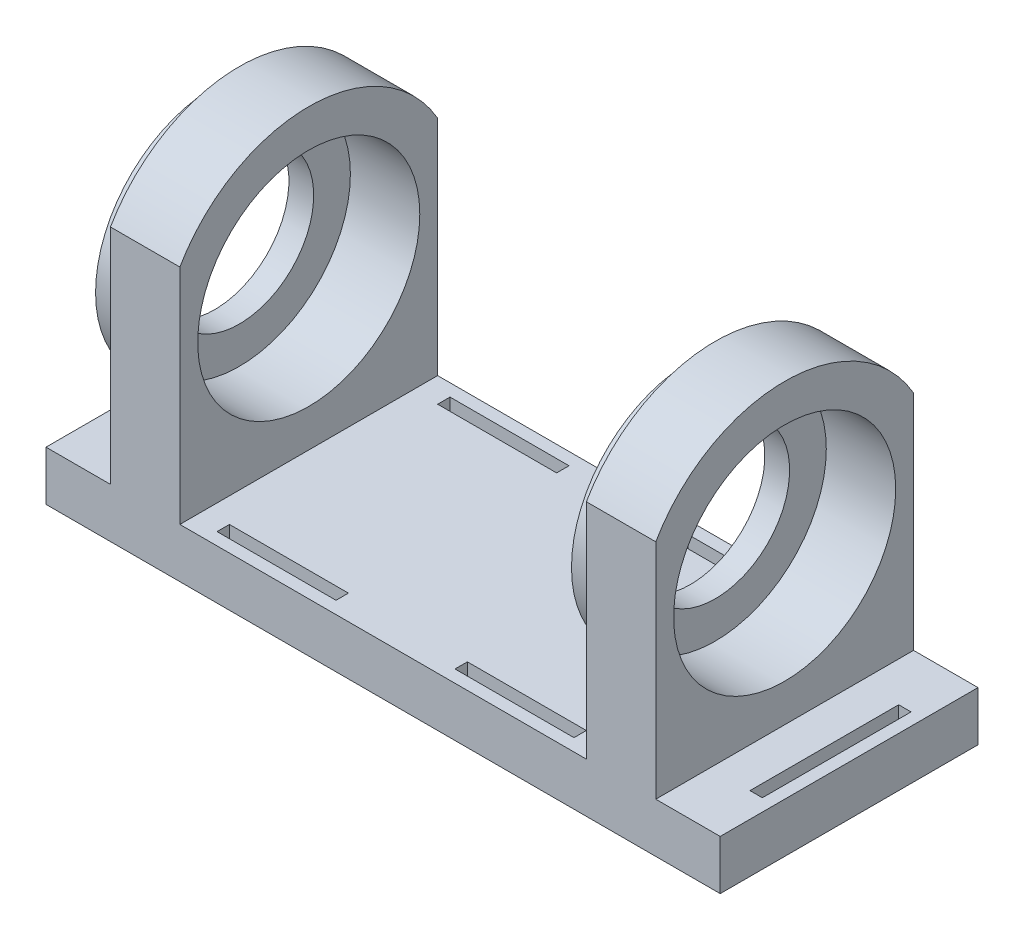
from build123d import *

# Parameters (mm, degrees)
SKETCH1_W            = 20
SKETCH1_H            = 26
SKETCH1_W_2          = 1.25
SKETCH1_H_2          = 15
BOSS_EXTRUDE5_DEPTH  = 5
SKETCH3_W            = 7
SKETCH3_H            = 26
BOSS_EXTRUDE6_DEPTH  = 40
CUT_EXTRUDE1_REACH   = 55.696
SKETCH5_R            = 11.2
SKETCH6_W            = 26
SKETCH6_H            = 5
BOSS_EXTRUDE8_DEPTH  = 14
SKETCH8_R            = 12
SKETCH8_R_2          = 7.5
BOSS_EXTRUDE9_DEPTH  = 2.5
SKETCH9_R            = 12
SKETCH9_R_2          = 7.5
BOSS_EXTRUDE10_DEPTH = 2.5
SKETCH7_W            = 12
SKETCH7_H            = 1.25
CUT_EXTRUDE2_DEPTH   = 10


with BuildPart() as part:
    # Sketch1 → Boss-Extrude5 (new body)
    with BuildSketch(Plane(origin=(0, 0, 0), x_dir=(1, 0, 0), z_dir=(0, 1, 0))):
        with Locations((10, 13)):
            Rectangle(SKETCH1_W, SKETCH1_H)
        with Locations((1.875, 13)):
            Rectangle(SKETCH1_W_2, SKETCH1_H_2, mode=Mode.SUBTRACT)
    boss_extrude5 = extrude(amount=BOSS_EXTRUDE5_DEPTH)

    # Sketch3 → Boss-Extrude6 (add)
    with BuildSketch(Plane(origin=(0, 5, 0), x_dir=(1, 0, 0), z_dir=(0, 1, 0))):
        with Locations((10, 13)):
            Rectangle(SKETCH3_W, SKETCH3_H)
    boss_extrude6 = extrude(amount=BOSS_EXTRUDE6_DEPTH)

    # Sketch5 → Cut-Extrude1 (cut, up to next)
    with BuildSketch(Plane(origin=(13.5, 0, 0), x_dir=(0, 0, -1), z_dir=(1, 0, 0)), mode=Mode.PRIVATE) as cut_extrude1_sk1:
        with Locations((13, 20)):
            Circle(SKETCH5_R)
    cut_extrude1_tool1 = extrude(cut_extrude1_sk1.sketch, amount=-CUT_EXTRUDE1_REACH, mode=Mode.PRIVATE) & part.part
    # Sketch5 → Cut-Extrude1 (cut, up to next)
    with BuildSketch(Plane(origin=(13.5, 0, 0), x_dir=(0, 0, -1), z_dir=(1, 0, 0)), mode=Mode.PRIVATE) as cut_extrude1_sk2:
        with BuildLine():
            Line((0, 27.483314774), (0, 45))
            Line((0, 45), (26, 45))
            Line((26, 45), (26, 27.483314774))
            ThreePointArc((26, 27.483314774), (13, 35), (0, 27.483314774))
        make_face()
    cut_extrude1_tool2 = extrude(cut_extrude1_sk2.sketch, amount=-CUT_EXTRUDE1_REACH, mode=Mode.PRIVATE) & part.part
    cut_extrude1_1 = cut_extrude1_tool1.solids().sort_by_distance((13.5, 20, -13))[0]
    add(cut_extrude1_1, mode=Mode.SUBTRACT)
    cut_extrude1_2 = cut_extrude1_tool2.solids().sort_by_distance((13.5, 38.725293, -13))[0]
    add(cut_extrude1_2, mode=Mode.SUBTRACT)
    cut_extrude1 = cut_extrude1_1 + cut_extrude1_2  # Cut-Extrude1 as one shape, for the pattern or mirror that repeats it

    # Sketch6 → Boss-Extrude8 (add)
    with BuildSketch(Plane(origin=(20, 0, 0), x_dir=(0, 0, -1), z_dir=(1, 0, 0))):
        with Locations((13, 2.5)):
            Rectangle(SKETCH6_W, SKETCH6_H)
    boss_extrude8 = extrude(amount=BOSS_EXTRUDE8_DEPTH)

    # Mirror5: Boss-Extrude5, Boss-Extrude6, Cut-Extrude1, Boss-Extrude8 across plane
    add(boss_extrude5.mirror(Plane.ZY.offset(-34)))
    add(boss_extrude6.mirror(Plane.ZY.offset(-34)))
    add(cut_extrude1.mirror(Plane.ZY.offset(-34)), mode=Mode.SUBTRACT)
    add(boss_extrude8.mirror(Plane.ZY.offset(-34)))

    # Sketch8 → Boss-Extrude9 (add)
    with BuildSketch(Plane.ZY.offset(-6.5)):
        with Locations(Location((-13, 20, 0), (0, 0, 180))):
            Circle(SKETCH8_R)
        with Locations((-13, 20)):
            Circle(SKETCH8_R_2, mode=Mode.SUBTRACT)
    extrude(amount=BOSS_EXTRUDE9_DEPTH)

    # Sketch9 → Boss-Extrude10 (add)
    with BuildSketch(Plane.ZY.offset(-54.5)):
        with Locations(Location((-13, 20, 0), (0, 0, 180))):
            Circle(SKETCH9_R)
        with Locations((-13, 20)):
            Circle(SKETCH9_R_2, mode=Mode.SUBTRACT)
    extrude(amount=BOSS_EXTRUDE10_DEPTH)

    # Sketch7 → Cut-Extrude2 (cut)
    with BuildSketch(Plane(origin=(0, 5, 0), x_dir=(1, 0, 0), z_dir=(0, 1, 0))):
        with Locations((22, 1.875)):
            Rectangle(SKETCH7_W, SKETCH7_H)
        with Locations((46, 1.875)):
            Rectangle(SKETCH7_W, SKETCH7_H)
        with Locations((46, 24.125)):
            Rectangle(SKETCH7_W, SKETCH7_H)
        with Locations((22, 24.125)):
            Rectangle(SKETCH7_W, SKETCH7_H)
    extrude(amount=-CUT_EXTRUDE2_DEPTH, mode=Mode.SUBTRACT)


solid = part.part
